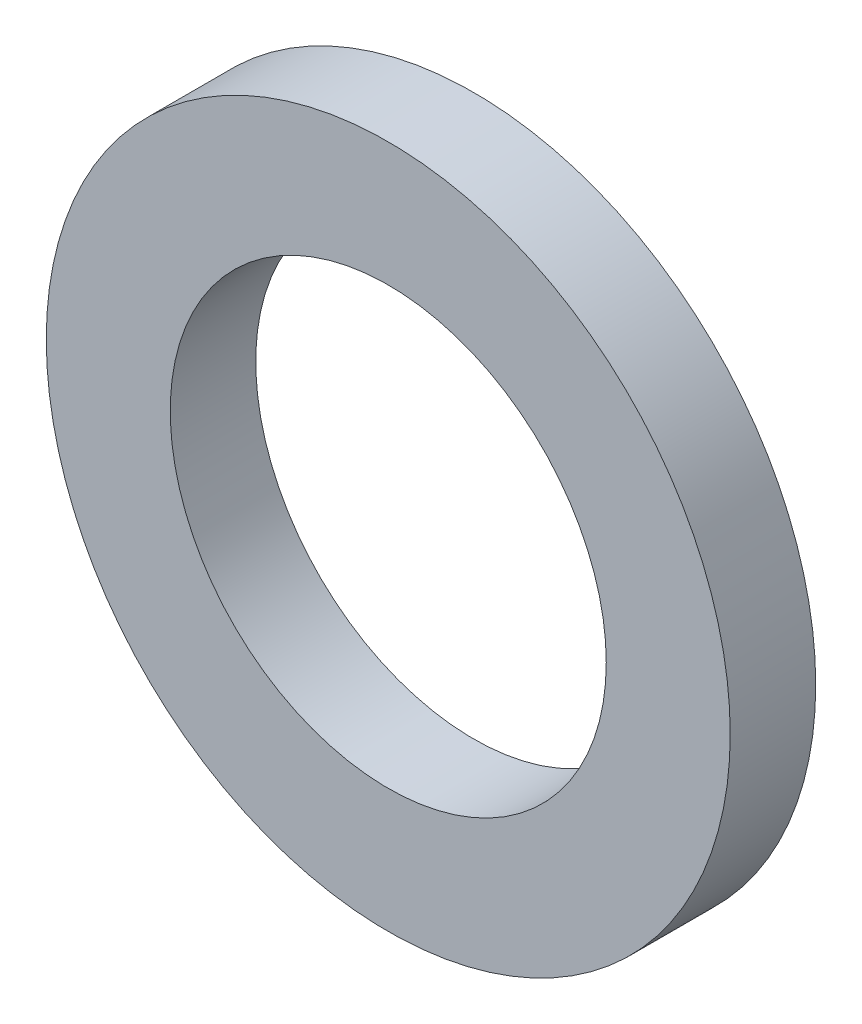
from build123d import *

# Parameters (mm, degrees)
ESQUISSE1_R          = 8
ESQUISSE1_R_2        = 5.1
BASE_EXTRUSION_DEPTH = 2


with BuildPart() as part:
    # Esquisse1 → Base-Extrusion (new body)
    with BuildSketch(Plane.XY):
        Circle(ESQUISSE1_R)
        Circle(ESQUISSE1_R_2, mode=Mode.SUBTRACT)
    extrude(amount=BASE_EXTRUSION_DEPTH)


solid = part.part
